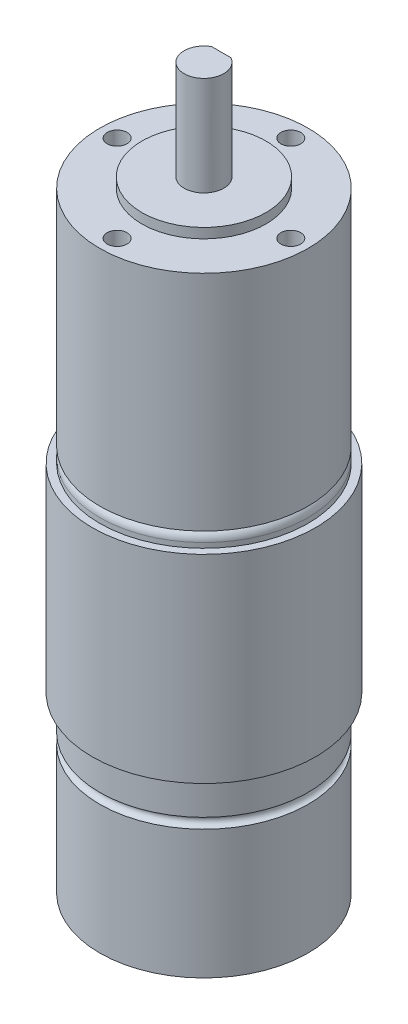
from build123d import *

# Parameters (mm, degrees)
CUT_EXTRUDE1_START = -12
CUT_EXTRUDE1_DEPTH = 12
SKETCH3_R          = 2
CUT_EXTRUDE2_DEPTH = 4


with BuildPart() as part:
    # Sketch1 → Revolve1 (revolve)
    with BuildSketch(Plane.XY, mode=Mode.PRIVATE) as revolve1_sk:
        with BuildLine():
            ThreePointArc((21, 28.039082801), (19.960917199, 27), (21, 25.960917199))
            Line((21, 25.960917199), (21, 0))
            Line((21, 0), (0, 0))
            Line((0, 0), (0, 145))
            Line((0, 145), (4, 145))
            Line((4, 145), (4, 125))
            Line((4, 125), (12.5, 125))
            Line((12.5, 125), (12.5, 123))
            Line((12.5, 123), (21, 123))
            Line((21, 123), (21, 78))
            Line((21, 78), (19, 78))
            ThreePointArc((19, 78), (20.414213562, 77.414213562), (21, 76))
            Line((21, 76), (21, 75))
            Line((21, 75), (22.5, 75))
            Line((22.5, 75), (22.5, 35))
            Line((22.5, 35), (21, 35))
            Line((21, 35), (21, 28.039082801))
        make_face()
    revolve(revolve1_sk.sketch.rotate(Axis((0, 180.020988846, 0), (0, -1, 0)), 90), axis=Axis((0, 180.020988846, 0), (0, -1, 0)))

    # Sketch2 → Cut-Extrude1 (cut)
    with BuildSketch(Plane(origin=(0, 145, 0), x_dir=(1, 0, 0), z_dir=(0, 1, 0)).offset(CUT_EXTRUDE1_START)):
        with BuildLine():
            Line((-1.936491673, 3.5), (1.936491673, 3.5))
            ThreePointArc((1.936491673, 3.5), (0, 4), (-1.936491673, 3.5))
        make_face()
    extrude(amount=CUT_EXTRUDE1_DEPTH, mode=Mode.SUBTRACT)

    # Sketch3 → Cut-Extrude2 (cut)
    with BuildSketch(Plane(origin=(0, 123, 0), x_dir=(1, 0, 0), z_dir=(0, 1, 0))):
        with Locations(Location((0, 17.5, 0), (0, 0, 270))):
            Circle(SKETCH3_R)
        with Locations(Location((17.5, 0, 0), (0, 0, 270))):
            Circle(SKETCH3_R)
        with Locations(Location((0, -17.5, 0), (0, 0, 270))):
            Circle(SKETCH3_R)
        with Locations(Location((-17.5, 0, 0), (0, 0, 270))):
            Circle(SKETCH3_R)
    extrude(amount=-CUT_EXTRUDE2_DEPTH, mode=Mode.SUBTRACT)


solid = part.part
